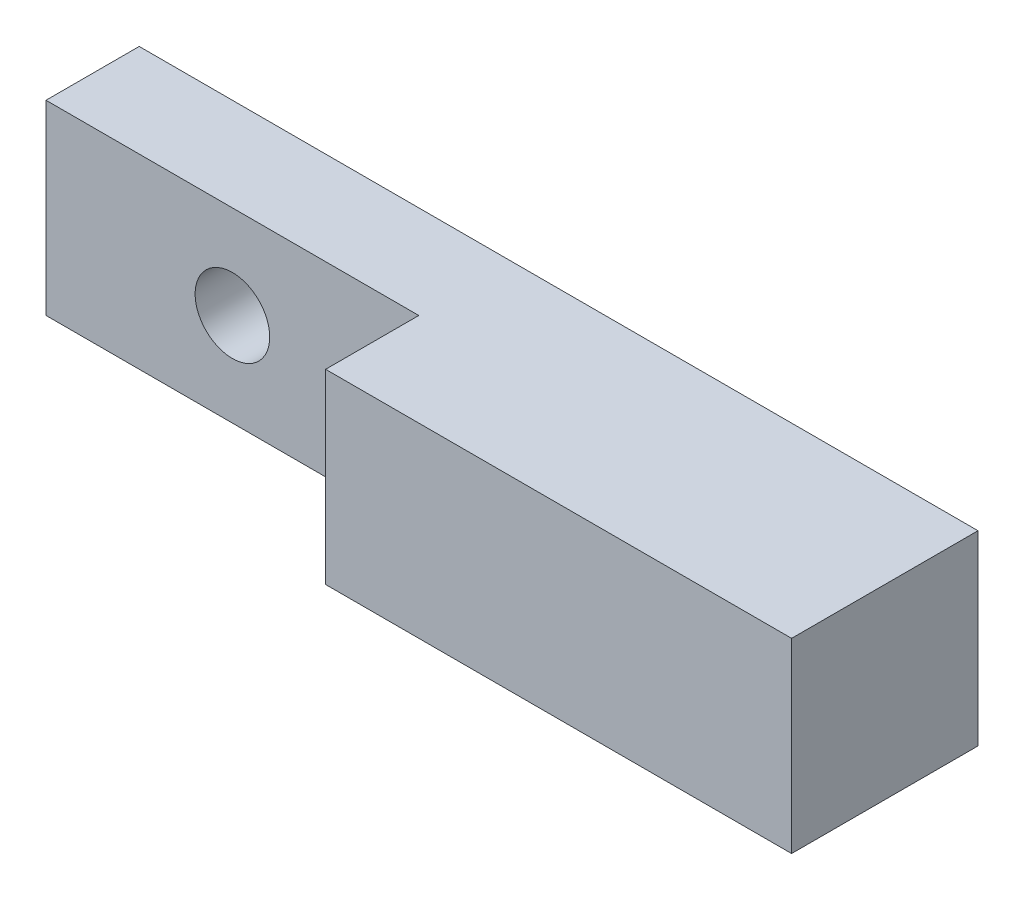
from build123d import *

# Parameters (mm, degrees)
SKETCH1_W           = 45
SKETCH1_H           = 10
BOSS_EXTRUDE1_DEPTH = 10
SKETCH2_W           = 20
SKETCH2_H           = 10
CUT_EXTRUDE1_DEPTH  = 5
SKETCH3_R           = 2
CUT_EXTRUDE2_DEPTH  = 5


with BuildPart() as part:
    # Sketch1 → Boss-Extrude1 (new body)
    with BuildSketch(Plane.XY):
        with Locations((22.5, 5)):
            Rectangle(SKETCH1_W, SKETCH1_H)
    extrude(amount=BOSS_EXTRUDE1_DEPTH)

    # Sketch2 → Cut-Extrude1 (cut)
    with BuildSketch(Plane.XY.offset(10)):
        with Locations((10, 5)):
            Rectangle(SKETCH2_W, SKETCH2_H)
    extrude(amount=-CUT_EXTRUDE1_DEPTH, mode=Mode.SUBTRACT)

    # Sketch3 → Cut-Extrude2 (cut)
    with BuildSketch(Plane.XY.offset(5)):
        with Locations((10, 5)):
            Circle(SKETCH3_R)
    extrude(amount=-CUT_EXTRUDE2_DEPTH, mode=Mode.SUBTRACT)


solid = part.part
